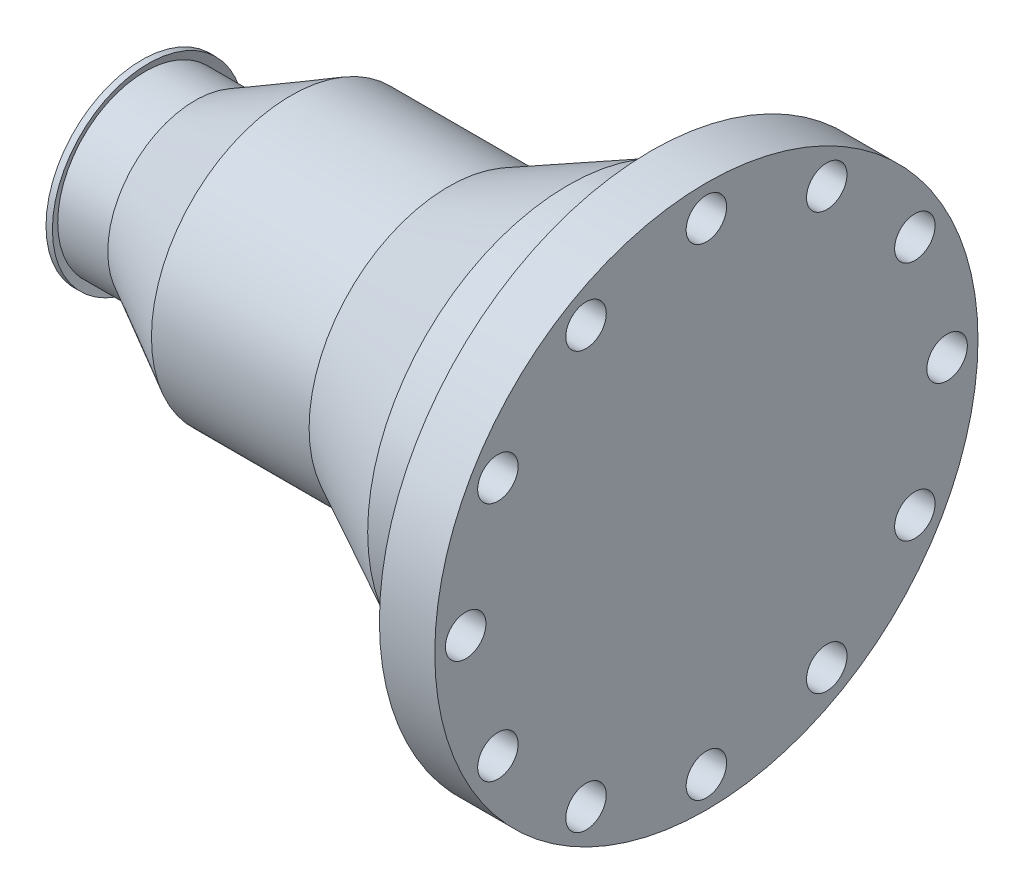
from build123d import *

# Parameters (mm, degrees)
SKETCH_3_R           = 9.5
CUT_EXTRUDE_1_DEPTH  = 321.526909947
SKETCH_4_R           = 9.5
CUT_EXTRUDE_2_DEPTH  = 321.526909947
SKETCH_5_R           = 9.5
CUT_EXTRUDE_3_DEPTH  = 321.526909947
SKETCH_6_R           = 9.5
CUT_EXTRUDE_4_DEPTH  = 321.526909947
SKETCH_7_R           = 9.5
CUT_EXTRUDE_5_DEPTH  = 321.526909947
SKETCH_8_R           = 9.5
CUT_EXTRUDE_6_DEPTH  = 321.526909947
SKETCH_9_R           = 9.5
CUT_EXTRUDE_7_DEPTH  = 321.526909947
SKETCH_10_R          = 9.5
CUT_EXTRUDE_8_DEPTH  = 321.526909947
SKETCH_11_R          = 9.5
CUT_EXTRUDE_9_DEPTH  = 321.526909947
SKETCH_12_R          = 9.5
CUT_EXTRUDE_10_DEPTH = 321.526909947
SKETCH_13_R          = 9.5
CUT_EXTRUDE_11_DEPTH = 321.526909947
SKETCH_14_R          = 9.5
CUT_EXTRUDE_12_DEPTH = 321.526909947


with BuildPart() as part:
    # Эскиз1 → Повернуть1 (revolve)
    with BuildSketch(Plane.XY, mode=Mode.PRIVATE) as revolve_1_sk:
        Polygon((0, 0), (265, 0), (265, 127.5), (239, 127.5), (239, 100), (239, 95), (220, 95), (220, 94), (200, 94), (144, 65.5), (70, 65.5), (25, 41), (1.5, 41), (3, 45), (0, 45), align=None)
    revolve(revolve_1_sk.sketch.rotate(Axis((0, 0, 0), (1, 0, 0)), 90), axis=Axis((0, 0, 0), (1, 0, 0)))

    # Эскиз2 → Вырез-Повернуть1 (revolve, cut)
    with BuildSketch(Plane.XY, mode=Mode.PRIVATE) as cut_revolve_1_sk:
        with BuildLine():
            Line((0, 0), (215.831336185, 0))
            Line((215.831336185, 0), (215.831336185, 52.583474267))
            Line((215.831336185, 52.583474267), (133.831336185, 52.583474267))
            Line((133.831336185, 52.583474267), (128.830273914, 52.583474267))
            ThreePointArc((128.830273914, 52.583474267), (122.304621517, 52.09322577), (115.89038393, 50.796291315))
            Line((115.89038393, 50.796291315), (42, 31))
            Line((42, 31), (0, 31))
            Line((0, 31), (0, 0))
        make_face()
    revolve(cut_revolve_1_sk.sketch.rotate(Axis((0, 0, 0), (1, 0, 0)), 90), axis=Axis((0, 0, 0), (1, 0, 0)), mode=Mode.SUBTRACT)

    # Эскиз3 → Вырез-Вытянуть1 (cut, through all)
    with BuildSketch(Plane(origin=(0, 0, 0), x_dir=(0, 0, -1), z_dir=(1, 0, 0))):
        with Locations((0, 113)):
            Circle(SKETCH_3_R)
    extrude(amount=CUT_EXTRUDE_1_DEPTH, mode=Mode.SUBTRACT)

    # Эскиз4 → Вырез-Вытянуть2 (cut, through all)
    with BuildSketch(Plane(origin=(0, 0, 0), x_dir=(0, 0, -1), z_dir=(1, 0, 0))):
        with Locations((-56.5, 97.860870628)):
            Circle(SKETCH_4_R)
    extrude(amount=CUT_EXTRUDE_2_DEPTH, mode=Mode.SUBTRACT)

    # Эскиз5 → Вырез-Вытянуть3 (cut, through all)
    with BuildSketch(Plane(origin=(0, 0, 0), x_dir=(0, 0, -1), z_dir=(1, 0, 0))):
        with Locations((-97.860870628, 56.5)):
            Circle(SKETCH_5_R)
    extrude(amount=CUT_EXTRUDE_3_DEPTH, mode=Mode.SUBTRACT)

    # Эскиз6 → Вырез-Вытянуть4 (cut, through all)
    with BuildSketch(Plane(origin=(0, 0, 0), x_dir=(0, 0, -1), z_dir=(1, 0, 0))):
        with Locations((-113, 0)):
            Circle(SKETCH_6_R)
    extrude(amount=CUT_EXTRUDE_4_DEPTH, mode=Mode.SUBTRACT)

    # Эскиз7 → Вырез-Вытянуть5 (cut, through all)
    with BuildSketch(Plane(origin=(0, 0, 0), x_dir=(0, 0, -1), z_dir=(1, 0, 0))):
        with Locations((-97.860870628, -56.5)):
            Circle(SKETCH_7_R)
    extrude(amount=CUT_EXTRUDE_5_DEPTH, mode=Mode.SUBTRACT)

    # Эскиз8 → Вырез-Вытянуть6 (cut, through all)
    with BuildSketch(Plane(origin=(0, 0, 0), x_dir=(0, 0, -1), z_dir=(1, 0, 0))):
        with Locations((-56.5, -97.860870628)):
            Circle(SKETCH_8_R)
    extrude(amount=CUT_EXTRUDE_6_DEPTH, mode=Mode.SUBTRACT)

    # Эскиз9 → Вырез-Вытянуть7 (cut, through all)
    with BuildSketch(Plane(origin=(0, 0, 0), x_dir=(0, 0, -1), z_dir=(1, 0, 0))):
        with Locations((0, -113)):
            Circle(SKETCH_9_R)
    extrude(amount=CUT_EXTRUDE_7_DEPTH, mode=Mode.SUBTRACT)

    # Эскиз10 → Вырез-Вытянуть8 (cut, through all)
    with BuildSketch(Plane(origin=(0, 0, 0), x_dir=(0, 0, -1), z_dir=(1, 0, 0))):
        with Locations((56.5, -97.860870628)):
            Circle(SKETCH_10_R)
    extrude(amount=CUT_EXTRUDE_8_DEPTH, mode=Mode.SUBTRACT)

    # Эскиз11 → Вырез-Вытянуть9 (cut, through all)
    with BuildSketch(Plane(origin=(0, 0, 0), x_dir=(0, 0, -1), z_dir=(1, 0, 0))):
        with Locations((97.860870628, -56.5)):
            Circle(SKETCH_11_R)
    extrude(amount=CUT_EXTRUDE_9_DEPTH, mode=Mode.SUBTRACT)

    # Эскиз12 → Вырез-Вытянуть10 (cut, through all)
    with BuildSketch(Plane(origin=(0, 0, 0), x_dir=(0, 0, -1), z_dir=(1, 0, 0))):
        with Locations((113, 0)):
            Circle(SKETCH_12_R)
    extrude(amount=CUT_EXTRUDE_10_DEPTH, mode=Mode.SUBTRACT)

    # Эскиз13 → Вырез-Вытянуть11 (cut, through all)
    with BuildSketch(Plane(origin=(0, 0, 0), x_dir=(0, 0, -1), z_dir=(1, 0, 0))):
        with Locations((97.860870628, 56.5)):
            Circle(SKETCH_13_R)
    extrude(amount=CUT_EXTRUDE_11_DEPTH, mode=Mode.SUBTRACT)

    # Эскиз14 → Вырез-Вытянуть12 (cut, through all)
    with BuildSketch(Plane(origin=(0, 0, 0), x_dir=(0, 0, -1), z_dir=(1, 0, 0))):
        with Locations((56.5, 97.860870628)):
            Circle(SKETCH_14_R)
    extrude(amount=CUT_EXTRUDE_12_DEPTH, mode=Mode.SUBTRACT)


solid = part.part
